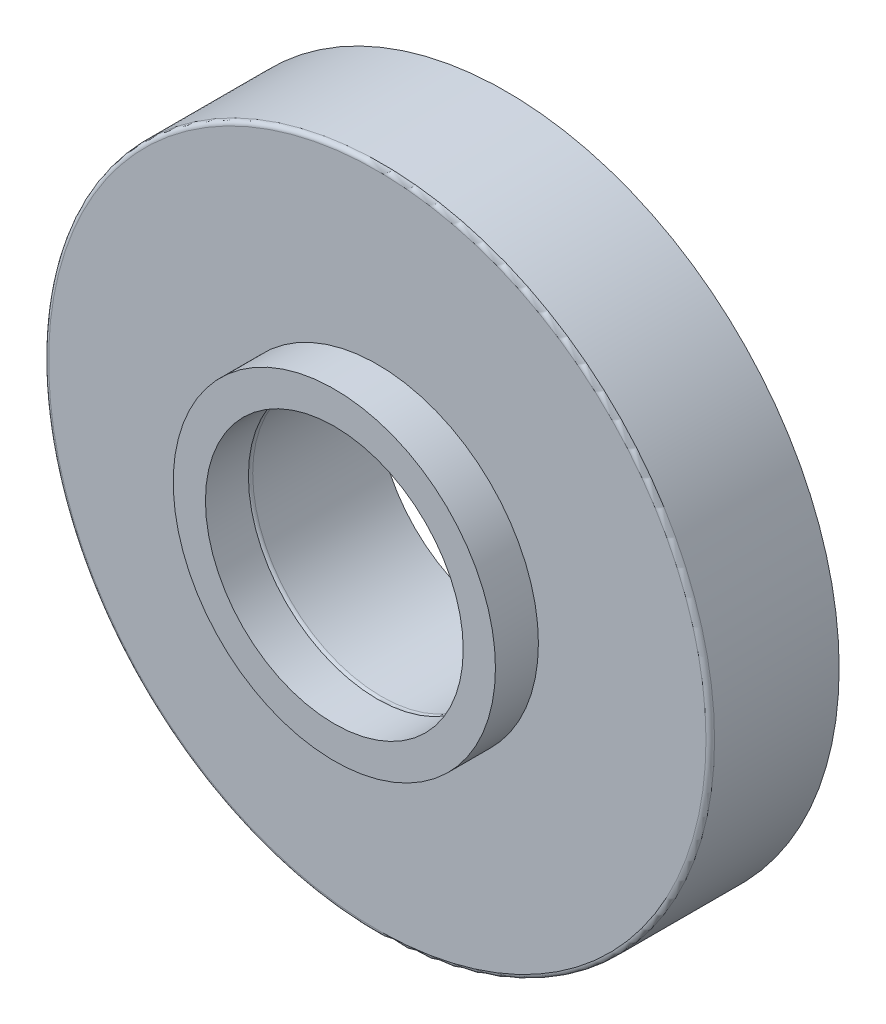
from build123d import *

# Parameters (mm, degrees)
SKETCH_1_R          = 7.75
EXTRUDE_1_DEPTH     = 3
SKETCH_2_R          = 3.75
EXTRUDE_2_DEPTH     = 1
SKETCH_3_R          = 3
CUT_EXTRUDE_1_DEPTH = 12.66726189
FILLET_1_R          = 0.1


with BuildPart() as part:
    # Эскиз1 → Бобышка-Вытянуть1 (new body)
    with BuildSketch(Plane.XY):
        Circle(SKETCH_1_R)
    extrude(amount=EXTRUDE_1_DEPTH)


with BuildPart() as body_2:
    # Эскиз2 → Бобышка-Вытянуть2 (new body)
    with BuildSketch(Plane.XY.offset(3)):
        Circle(SKETCH_2_R)
    extrude(amount=EXTRUDE_2_DEPTH)


with BuildPart() as cut_extrude_1_tool:
    # Эскиз3 → Вырез-Вытянуть1 (new, through all)
    with BuildSketch(Plane.XY.offset(4)):
        Circle(SKETCH_3_R)
    extrude(amount=-CUT_EXTRUDE_1_DEPTH)


with BuildPart() as part_1:
    add(part.part)

    # Вырез-Вытянуть1: cut by cut_extrude_1_tool
    add(cut_extrude_1_tool.part, mode=Mode.SUBTRACT)

    # Скругление1
    fillet_1_edges = [part_1.edges().sort_by_distance(p)[0] for p in [
        (-7.75, 0, 3),
        (-3, 0, 3),
    ]]
    fillet(fillet_1_edges, radius=FILLET_1_R)


with BuildPart() as body_2_1:
    add(body_2.part)

    # Вырез-Вытянуть1: cut by cut_extrude_1_tool
    add(cut_extrude_1_tool.part, mode=Mode.SUBTRACT)


solid = Compound([part_1.part, body_2_1.part])
